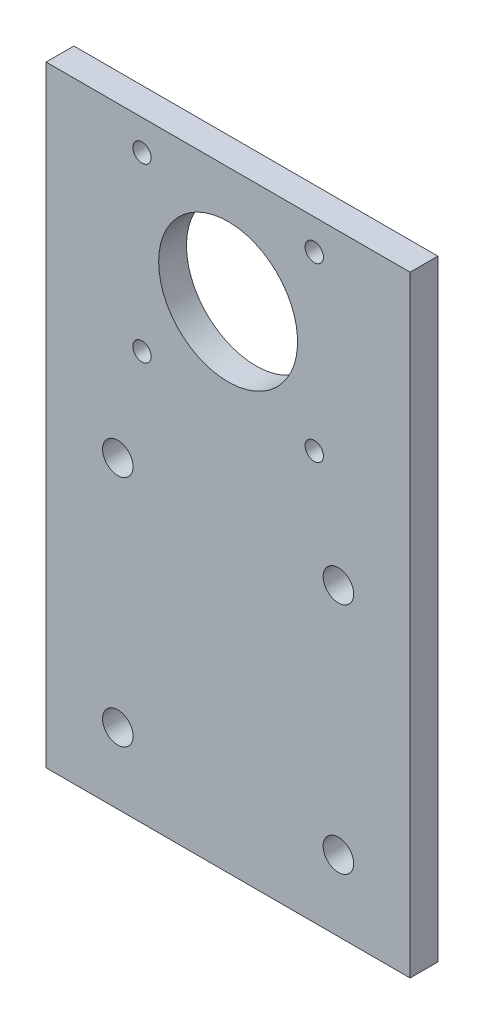
from build123d import *

# Parameters (mm, degrees)
SKETCH1_W           = 65.5
SKETCH1_H           = 110
BOSS_EXTRUDE1_DEPTH = 5
SKETCH2_R           = 12.5
CUT_EXTRUDE1_DEPTH  = 65.207184177
SKETCH3_R           = 1.65
CUT_EXTRUDE2_DEPTH  = 65.207184177
SKETCH4_R           = 2.75
CUT_EXTRUDE3_DEPTH  = 65.207184177


with BuildPart() as part:
    # Sketch1 → Boss-Extrude1 (new body)
    with BuildSketch(Plane.XY):
        Rectangle(SKETCH1_W, SKETCH1_H)
    extrude(amount=BOSS_EXTRUDE1_DEPTH)

    # Sketch2 → Cut-Extrude1 (cut, through all)
    with BuildSketch(Plane(origin=(0, 0, 0), x_dir=(-1, 0, 0), z_dir=(0, 0, -1))):
        with Locations((0, 34.025)):
            Circle(SKETCH2_R)
    extrude(amount=-CUT_EXTRUDE1_DEPTH, mode=Mode.SUBTRACT)

    # Sketch3 → Cut-Extrude2 (cut, through all)
    with BuildSketch(Plane(origin=(0, 0, 0), x_dir=(-1, 0, 0), z_dir=(0, 0, -1))):
        with Locations((-15.5, 49.525)):
            Circle(SKETCH3_R)
        with Locations((-15.5, 18.525)):
            Circle(SKETCH3_R)
        with Locations((15.5, 18.525)):
            Circle(SKETCH3_R)
        with Locations((15.5, 49.525)):
            Circle(SKETCH3_R)
    extrude(amount=-CUT_EXTRUDE2_DEPTH, mode=Mode.SUBTRACT)

    # Sketch4 → Cut-Extrude3 (cut, through all)
    with BuildSketch(Plane(origin=(0, 0, 0), x_dir=(-1, 0, 0), z_dir=(0, 0, -1))):
        with Locations((-19.85, -0.25)):
            Circle(SKETCH4_R)
        with Locations((19.85, -0.25)):
            Circle(SKETCH4_R)
        with Locations((19.85, -42.25)):
            Circle(SKETCH4_R)
        with Locations((-19.85, -42.25)):
            Circle(SKETCH4_R)
    extrude(amount=-CUT_EXTRUDE3_DEPTH, mode=Mode.SUBTRACT)


solid = part.part
